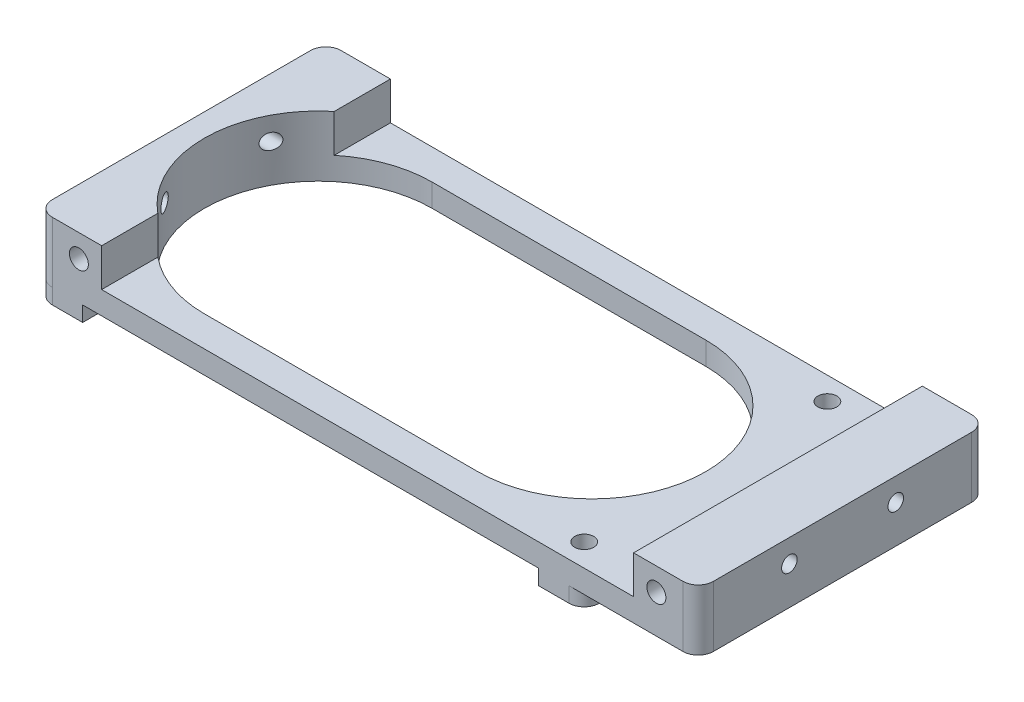
from build123d import *

# Parameters (mm, degrees)
BOSS_EXTRUDE1_DEPTH          = 38
FILLET3_R                    = 2
CUT_EXTRUDE1_DEPTH           = 98.532671663
CUT_EXTRUDE1_DEPTH_BACK      = 98.532671663
M3X0_5_TAPPED_HOLE2_D        = 2.5
M3X0_5_TAPPED_HOLE2_DEPTH    = 7.5
M3X0_5_TAPPED_HOLE2_TIP      = 0.751075774
M3X0_5_TAPPED_HOLE3_D        = 2.5
M3X0_5_TAPPED_HOLE3_DEPTH    = 7.5
M3X0_5_TAPPED_HOLE3_TIP      = 0.751075774
M2_5X0_45_TAPPED_HOLE1_D     = 2.05
M2_5X0_45_TAPPED_HOLE1_DEPTH = 6.35
M2_5X0_45_TAPPED_HOLE1_TIP   = 0.615882135
M2_5X0_45_TAPPED_HOLE2_D     = 2.05
M2_5X0_45_TAPPED_HOLE2_DEPTH = 6.35
M2_5X0_45_TAPPED_HOLE2_TIP   = 0.615882135
SKETCH13_W                   = 6
SKETCH13_H                   = 6
BOSS_EXTRUDE3_DEPTH          = 2
FILLET6_R                    = 2
M3X0_5_TAPPED_HOLE4_D        = 2.5
M3X0_5_TAPPED_HOLE4_DEPTH    = 5.2
M3X0_5_TAPPED_HOLE4_TIP      = 0.751075774


with BuildPart() as part:
    # Sketch2 → Boss-Extrude1 (new body)
    with BuildSketch(Plane.XY.offset(11.2)):
        Polygon((-84.06534388, 85.95185693), (-75.56534388, 85.95185693), (-75.56534388, 80.95185693), (-5.56534388, 80.95185693), (-5.56534388, 85.95185693), (2.93465612, 85.95185693), (2.93465612, 77.95185693), (-84.06534388, 77.95185693), align=None)
    extrude(amount=BOSS_EXTRUDE1_DEPTH)

    # Fillet3
    fillet3_edges = [part.edges().sort_by_distance(p)[0] for p in [
        (2.93465612, 81.95185693, 49.2),
        (-84.06534388, 81.95185693, 11.2),
        (-84.06534388, 81.95185693, 49.2),
        (2.93465612, 81.95185693, 11.2),
    ]]
    fillet(fillet3_edges, radius=FILLET3_R)

    # Sketch3 → Cut-Extrude1 (cut, two sides: drawn at the far end of the back side and taken through both)
    with BuildSketch(Plane(origin=(0, 80.95185693, 0), x_dir=(1, 0, 0), z_dir=(0, 1, 0)).offset(-CUT_EXTRUDE1_DEPTH_BACK)):
        with BuildLine():
            Line((-66.06534388, -15.2), (-30.06534388, -15.2))
            ThreePointArc((-30.06534388, -15.2), (-15.06534388, -30.2), (-30.06534388, -45.2))
            Line((-30.06534388, -45.2), (-66.06534388, -45.2))
            ThreePointArc((-66.06534388, -45.2), (-81.06534388, -30.2), (-66.06534388, -15.2))
        make_face()
    extrude(amount=CUT_EXTRUDE1_DEPTH + CUT_EXTRUDE1_DEPTH_BACK, mode=Mode.SUBTRACT)

    # M3x0.5 Tapped Hole2
    with Locations(Plane(origin=(0, 0, 11.2), x_dir=(-1, 0, 0), z_dir=(0, 0, -1))):
        with Locations((78.56534388, 82.95185693), (2.56534388, 82.95185693)):
            Hole(M3X0_5_TAPPED_HOLE2_D / 2, depth=M3X0_5_TAPPED_HOLE2_DEPTH)
            with Locations((0, 0, -(M3X0_5_TAPPED_HOLE2_DEPTH + M3X0_5_TAPPED_HOLE2_TIP / 2))):  # 118° drill point
                Cone(0, M3X0_5_TAPPED_HOLE2_D / 2, M3X0_5_TAPPED_HOLE2_TIP, mode=Mode.SUBTRACT)

    # M3x0.5 Tapped Hole3
    with Locations(Plane.XY.offset(49.2)):
        with Locations((-2.56534388, 82.95185693), (-78.56534388, 82.95185693)):
            Hole(M3X0_5_TAPPED_HOLE3_D / 2, depth=M3X0_5_TAPPED_HOLE3_DEPTH)
            with Locations((0, 0, -(M3X0_5_TAPPED_HOLE3_DEPTH + M3X0_5_TAPPED_HOLE3_TIP / 2))):  # 118° drill point
                Cone(0, M3X0_5_TAPPED_HOLE3_D / 2, M3X0_5_TAPPED_HOLE3_TIP, mode=Mode.SUBTRACT)

    # M2.5x0.45 Tapped Hole1
    with Locations(Plane.ZY.offset(84.06534388)):
        with Locations((37.2, 82.95185693), (23.2, 82.95185693)):
            Hole(M2_5X0_45_TAPPED_HOLE1_D / 2, depth=M2_5X0_45_TAPPED_HOLE1_DEPTH)
            with Locations((0, 0, -(M2_5X0_45_TAPPED_HOLE1_DEPTH + M2_5X0_45_TAPPED_HOLE1_TIP / 2))):  # 118° drill point
                Cone(0, M2_5X0_45_TAPPED_HOLE1_D / 2, M2_5X0_45_TAPPED_HOLE1_TIP, mode=Mode.SUBTRACT)

    # M2.5x0.45 Tapped Hole2
    with Locations(Plane(origin=(2.93465612, 0, 0), x_dir=(0, 0, -1), z_dir=(1, 0, 0))):
        with Locations((-23.2, 82.95185693), (-37.2, 82.95185693)):
            Hole(M2_5X0_45_TAPPED_HOLE2_D / 2, depth=M2_5X0_45_TAPPED_HOLE2_DEPTH)
            with Locations((0, 0, -(M2_5X0_45_TAPPED_HOLE2_DEPTH + M2_5X0_45_TAPPED_HOLE2_TIP / 2))):  # 118° drill point
                Cone(0, M2_5X0_45_TAPPED_HOLE2_D / 2, M2_5X0_45_TAPPED_HOLE2_TIP, mode=Mode.SUBTRACT)

    # Sketch13 → Boss-Extrude3 (add)
    with BuildSketch(Plane.XZ.offset(-77.95185693)):
        with Locations((-81.06534388, 14.2)):
            Rectangle(SKETCH13_W, SKETCH13_H)
        with Locations((-81.06534388, 46.2)):
            Rectangle(SKETCH13_W, SKETCH13_H)
        with Locations((-15.06534388, 14.2)):
            Rectangle(SKETCH13_W, SKETCH13_H)
        with Locations((-15.06534388, 46.2)):
            Rectangle(SKETCH13_W, SKETCH13_H)
    extrude(amount=BOSS_EXTRUDE3_DEPTH)

    # Fillet6
    fillet6_edges = [part.edges().sort_by_distance(p)[0] for p in [
        (-12.06534388, 76.95185693, 49.2),
        (-12.06534388, 76.95185693, 11.2),
        (-84.06534388, 76.95185693, 11.2),
        (-84.06534388, 76.95185693, 49.2),
        (-78.06534388, 76.95185693, 17.2),
        (-78.06534388, 76.95185693, 43.2),
        (-18.06534388, 76.95185693, 43.2),
        (-18.06534388, 76.95185693, 17.2),
    ]]
    fillet(fillet6_edges, radius=FILLET6_R)

    # M3x0.5 Tapped Hole4
    with Locations(Plane.XZ.offset(-75.95185693)):
        with Locations((-15.06534388, 46.2), (-15.06534388, 14.2), (-81.06534388, 14.2), (-81.06534388, 46.2)):
            Hole(M3X0_5_TAPPED_HOLE4_D / 2, depth=M3X0_5_TAPPED_HOLE4_DEPTH)
            with Locations((0, 0, -(M3X0_5_TAPPED_HOLE4_DEPTH + M3X0_5_TAPPED_HOLE4_TIP / 2))):  # 118° drill point
                Cone(0, M3X0_5_TAPPED_HOLE4_D / 2, M3X0_5_TAPPED_HOLE4_TIP, mode=Mode.SUBTRACT)


solid = part.part
